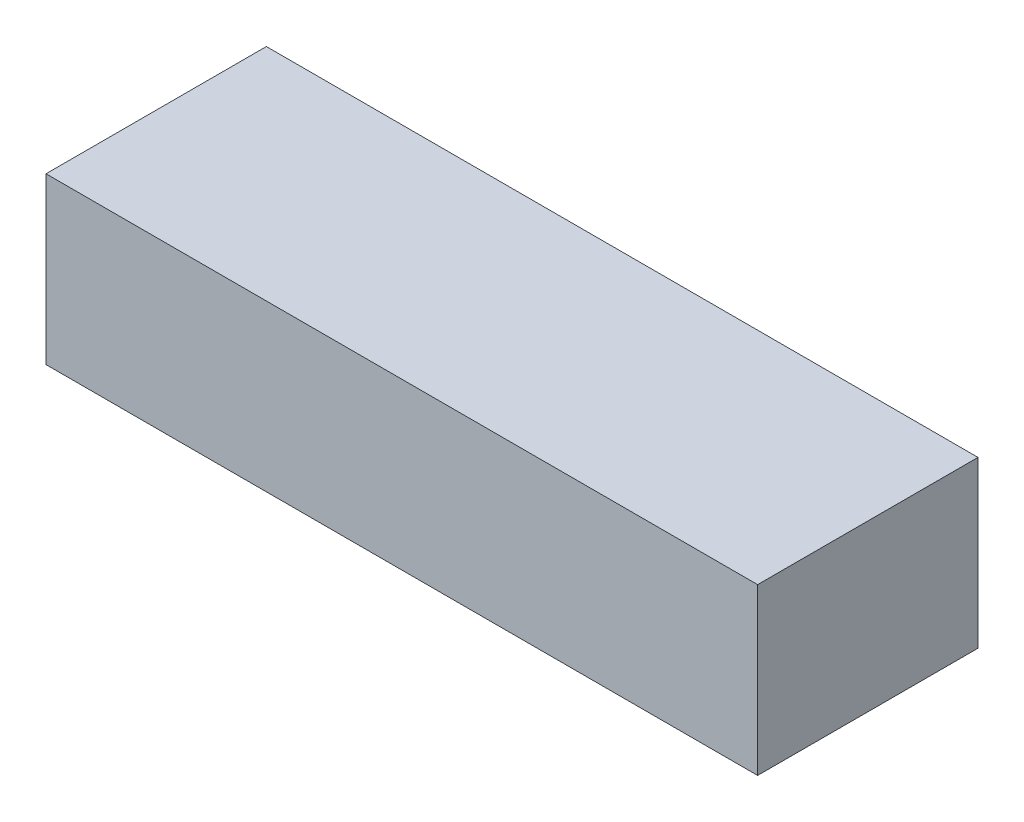
from build123d import *

# Parameters (mm, degrees)
SKETCH1_W           = 155
SKETCH1_H           = 48
BOSS_EXTRUDE1_DEPTH = 36
SKETCH2_W           = 11.207970655
SKETCH2_H           = 10.670963176
BOSS_EXTRUDE2_DEPTH = 10


with BuildPart() as part:
    # Sketch1 → Boss-Extrude1 (new body)
    with BuildSketch(Plane(origin=(0, 0, 0), x_dir=(1, 0, 0), z_dir=(0, 1, 0))):
        with Locations((77.5, -24)):
            Rectangle(SKETCH1_W, SKETCH1_H)
    extrude(amount=BOSS_EXTRUDE1_DEPTH)

    # Sketch2 → Boss-Extrude2 (add)
    with BuildSketch(Plane.ZY):
        with Locations((5.603985328, 18.209167022)):
            Rectangle(SKETCH2_W, SKETCH2_H)
    extrude(amount=BOSS_EXTRUDE2_DEPTH)


solid = part.part
